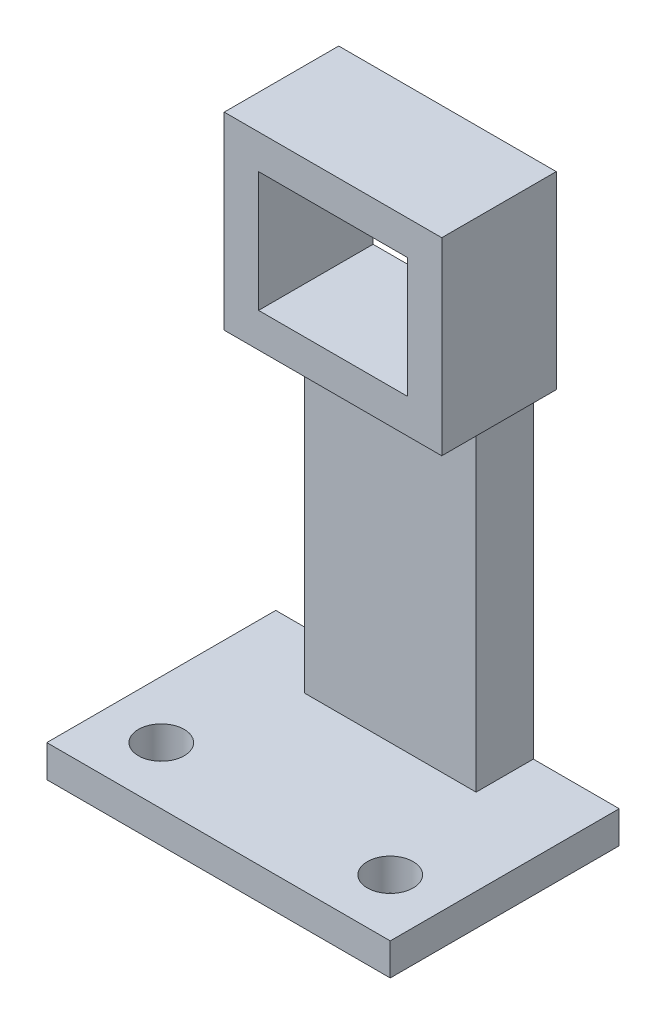
from build123d import *

# Parameters (mm, degrees)
SKETCH1_W           = 19
SKETCH1_H           = 16.5
SKETCH1_W_2         = 13
SKETCH1_H_2         = 10.5
BOSS_EXTRUDE1_DEPTH = 10
SKETCH1_3_W         = 15
SKETCH1_3_H         = 28.942025954
BOSS_EXTRUDE2_DEPTH = 5
SKETCH1_4_W         = 30
SKETCH1_4_H         = 2.807974046
BOSS_EXTRUDE3_DEPTH = 20
SKETCH2_R           = 2
CUT_EXTRUDE1_DEPTH  = 20


with BuildPart() as part:
    # Sketch1 → Boss-Extrude1 (new body)
    with BuildSketch(Plane.XY):
        Rectangle(SKETCH1_W, SKETCH1_H)
        Rectangle(SKETCH1_W_2, SKETCH1_H_2, mode=Mode.SUBTRACT)
    extrude(amount=BOSS_EXTRUDE1_DEPTH)

    # Sketch1<3> → Boss-Extrude2 (add)
    with BuildSketch(Plane.XY):
        with Locations((0, -22.721012977)):
            Rectangle(SKETCH1_3_W, SKETCH1_3_H)
    extrude(amount=BOSS_EXTRUDE2_DEPTH)

    # Sketch1<4> → Boss-Extrude3 (add)
    with BuildSketch(Plane.XY):
        with Locations((0, -38.596012977)):
            Rectangle(SKETCH1_4_W, SKETCH1_4_H)
    extrude(amount=BOSS_EXTRUDE3_DEPTH)

    # Sketch2 → Cut-Extrude1 (cut)
    with BuildSketch(Plane(origin=(0, -37.192025954, 0), x_dir=(1, 0, 0), z_dir=(0, 1, 0))):
        with Locations((-10, -15)):
            Circle(SKETCH2_R)
        with Locations((10, -15)):
            Circle(SKETCH2_R)
    extrude(amount=-CUT_EXTRUDE1_DEPTH, mode=Mode.SUBTRACT)


solid = part.part
